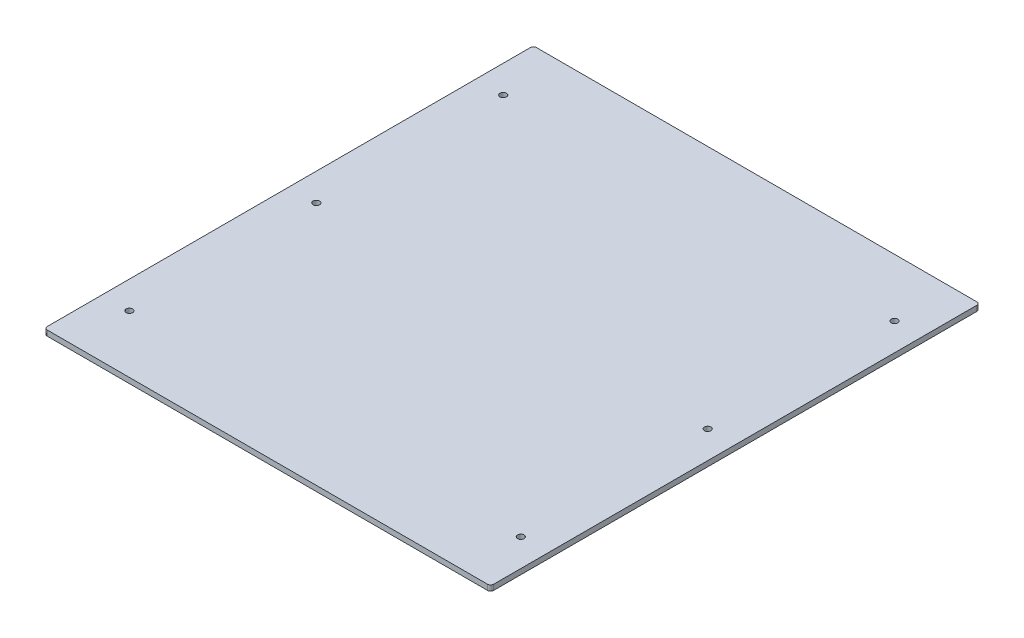
from build123d import *

# Parameters (mm, degrees)
SKETCH1_W           = 463.55
SKETCH1_H           = 508
SKETCH1_R           = 3.3782
BOSS_EXTRUDE1_DEPTH = 5.588
FILLET1_R           = 3.175


with BuildPart() as part:
    # Sketch1 → Boss-Extrude1 (new body)
    with BuildSketch(Plane(origin=(0, 0, 0), x_dir=(1, 0, 0), z_dir=(0, 1, 0))):
        with Locations((231.775, 254)):
            Rectangle(SKETCH1_W, SKETCH1_H)
        with Locations(Location((28.575, 59.944, 0), (0, 0, 270))):
            Circle(SKETCH1_R, mode=Mode.SUBTRACT)
        with Locations(Location((28.575, 254, 0), (0, 0, 270))):
            Circle(SKETCH1_R, mode=Mode.SUBTRACT)
        with Locations(Location((28.575, 448.056, 0), (0, 0, 270))):
            Circle(SKETCH1_R, mode=Mode.SUBTRACT)
        with Locations(Location((434.975, 448.056, 0), (0, 0, 90))):
            Circle(SKETCH1_R, mode=Mode.SUBTRACT)
        with Locations(Location((434.975, 254, 0), (0, 0, 90))):
            Circle(SKETCH1_R, mode=Mode.SUBTRACT)
        with Locations(Location((434.975, 59.944, 0), (0, 0, 90))):
            Circle(SKETCH1_R, mode=Mode.SUBTRACT)
    extrude(amount=BOSS_EXTRUDE1_DEPTH)

    # Fillet1
    fillet1_edges = [part.edges().sort_by_distance(p)[0] for p in [
        (0, 2.794, -508),
        (463.55, 2.794, -508),
        (463.55, 2.794, 0),
        (0, 2.794, 0),
    ]]
    fillet(fillet1_edges, radius=FILLET1_R)


solid = part.part
